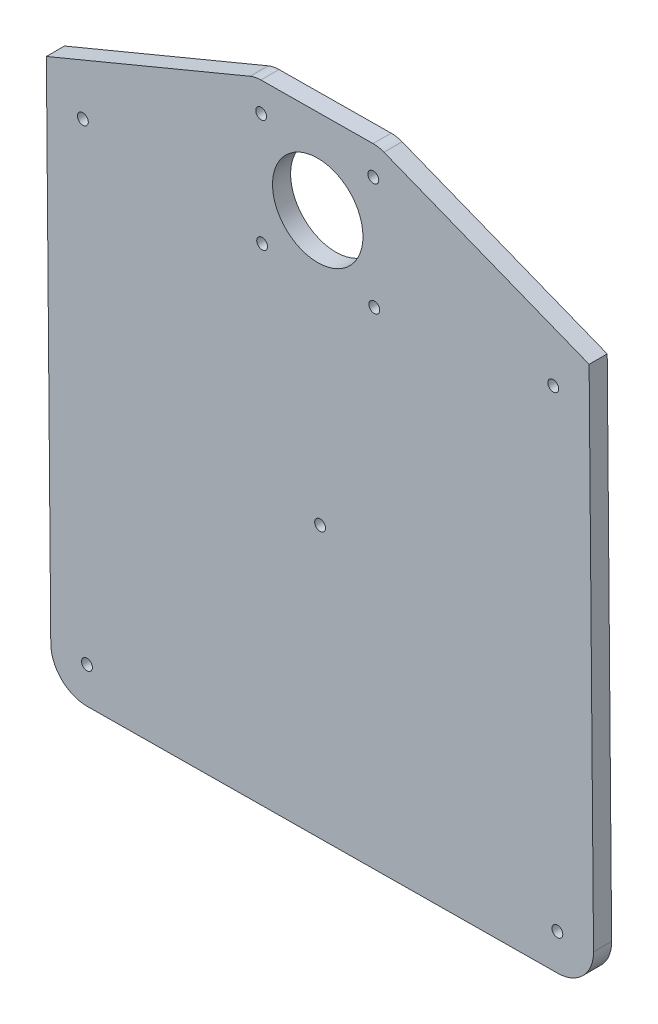
from build123d import *

# Parameters (mm, degrees)
SKETCH1_R             = 1.5
SKETCH1_R_2           = 12.5
BOSS_EXTRUDE1_DEPTH   = 5
BODY_MOVE_COPY1_ANGLE = 119.711745949


with BuildPart() as part:
    # Sketch1 → Boss-Extrude1 (new body)
    with BuildSketch(Plane(origin=(0, 0, 0), x_dir=(1, 0, 0), z_dir=(0, 1, 0))):
        with BuildLine():
            Line((-75, -75), (65, -75))
            ThreePointArc((65, -75), (72.071067812, -72.071067812), (75, -65))
            Line((75, -65), (75, 65))
            ThreePointArc((75, 65), (72.071067812, 72.071067812), (65, 75))
            Line((65, 75), (-75, 75))
            Line((-75, 75), (-97.913420794, 18.506857518))
            ThreePointArc((-97.913420794, 18.506857518), (-98.351985938, 17.031769181), (-98.5, 15.5))
            Line((-98.5, 15.5), (-98.5, -15.5))
            ThreePointArc((-98.5, -15.5), (-98.351985938, -17.031769181), (-97.913420794, -18.506857518))
            Line((-97.913420794, -18.506857518), (-75, -75))
        make_face()
        with Locations(Location((-90.5, 15.5, 0), (0, 0, 270))):
            Circle(SKETCH1_R, mode=Mode.SUBTRACT)
        with Locations(Location((-90.5, -15.5, 0), (0, 0, 270))):
            Circle(SKETCH1_R, mode=Mode.SUBTRACT)
        with Locations(Location((-59.5, -15.5, 0), (0, 0, 270))):
            Circle(SKETCH1_R, mode=Mode.SUBTRACT)
        with Locations(Location((-59.5, 15.5, 0), (0, 0, 270))):
            Circle(SKETCH1_R, mode=Mode.SUBTRACT)
        with Locations(Location((-75, 0, 0), (0, 0, 270))):
            Circle(SKETCH1_R_2, mode=Mode.SUBTRACT)
        with Locations(Location((-65, 65, 0), (0, 0, 270))):
            Circle(SKETCH1_R, mode=Mode.SUBTRACT)
        with Locations(Location((65, 65, 0), (0, 0, 270))):
            Circle(SKETCH1_R, mode=Mode.SUBTRACT)
        with Locations(Location((65, -65, 0), (0, 0, 270))):
            Circle(SKETCH1_R, mode=Mode.SUBTRACT)
        with Locations(Location((-65, -65, 0), (0, 0, 270))):
            Circle(SKETCH1_R, mode=Mode.SUBTRACT)
        with Locations(Location((0, 0, 0), (0, 0, 270))):
            Circle(SKETCH1_R, mode=Mode.SUBTRACT)
    extrude(amount=BOSS_EXTRUDE1_DEPTH)


with BuildPart() as part_1:
    # Body-Move/Copy1: moved
    add(part.part.moved(Location((0, 0, 0))).rotate(Axis((-6.951895858, -2.256414426, 4.756414426), (-0.5807091426084982, 0.5756634831611324, -0.5756634831615567)), BODY_MOVE_COPY1_ANGLE))


with BuildPart() as part_2:
    # Body-Move/Copy2: moved
    add(part_1.part.moved(Location((11.64746321, 9.2495526, 0))))


solid = part_2.part
